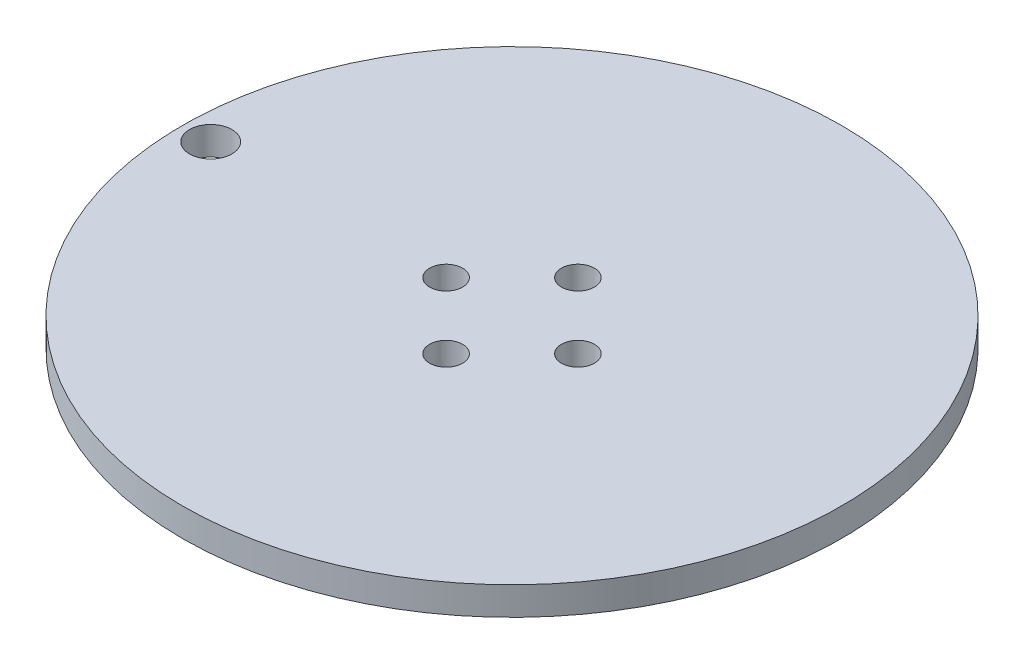
from build123d import *

# Parameters (mm, degrees)
SKETCH_1_R      = 35
SKETCH_1_R_2    = 1.75
SKETCH_1_R_3    = 2.25
EXTRUDE_1_DEPTH = 3


with BuildPart() as part:
    # 草图1 → 凸台-拉伸1 (new body)
    with BuildSketch(Plane(origin=(0, 0, 0), x_dir=(1, 0, 0), z_dir=(0, 1, 0))):
        with Locations(Location((0, 0, 0), (0, 0, 270))):
            Circle(SKETCH_1_R)
        with Locations(Location((-7, 0, 0), (0, 0, 270))):
            Circle(SKETCH_1_R_2, mode=Mode.SUBTRACT)
        with Locations(Location((0, 7, 0), (0, 0, 270))):
            Circle(SKETCH_1_R_2, mode=Mode.SUBTRACT)
        with Locations(Location((7, 0, 0), (0, 0, 270))):
            Circle(SKETCH_1_R_2, mode=Mode.SUBTRACT)
        with Locations(Location((0, -7, 0), (0, 0, 270))):
            Circle(SKETCH_1_R_2, mode=Mode.SUBTRACT)
        with Locations(Location((-32, 0, 0), (0, 0, 270))):
            Circle(SKETCH_1_R_3, mode=Mode.SUBTRACT)
    extrude(amount=EXTRUDE_1_DEPTH)


solid = part.part
